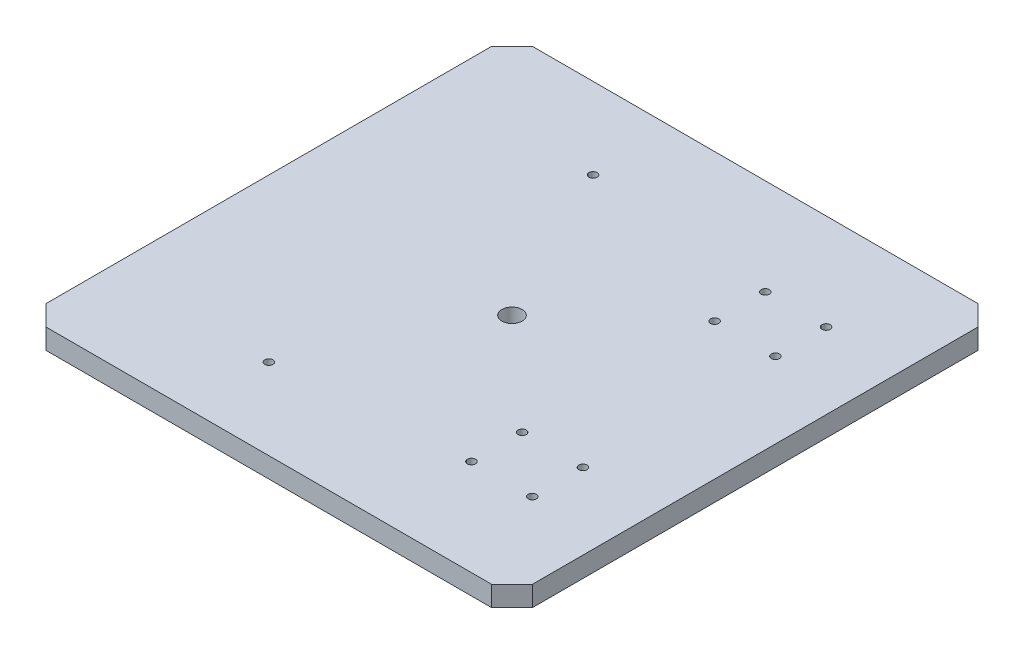
from build123d import *

# Parameters (mm, degrees)
SKETCH1_W               = 304.8
SKETCH1_H               = 304.8
BOSS_EXTRUDE1_DEPTH     = 12.7
CHAMFER1_SIZE           = 12.7
F_1_4_20_TAPPED_HOLE1_D = 5.1054
CUT_EXTRUDE1_DEPTH      = 432.239341897
CUT_EXTRUDE1_DEPTH_BACK = 432.239341897
SKETCH4_R               = 6.35
F_1_4_20_TAPPED_HOLE2_D = 5.1054


with BuildPart() as part:
    # Sketch1 → Boss-Extrude1 (new body)
    with BuildSketch(Plane(origin=(0, 0, 0), x_dir=(1, 0, 0), z_dir=(0, 1, 0))):
        with Locations((152.4, 152.4)):
            Rectangle(SKETCH1_W, SKETCH1_H)
    extrude(amount=BOSS_EXTRUDE1_DEPTH)

    # Chamfer1
    chamfer1_edges = [part.edges().sort_by_distance(p)[0] for p in [
        (0, 6.35, -304.8),
        (304.8, 6.35, -304.8),
        (304.8, 6.35, 0),
        (0, 6.35, 0),
    ]]
    chamfer(chamfer1_edges, length=CHAMFER1_SIZE)

    # 1/4-20 Tapped Hole1 (through all)
    with Locations(Plane(origin=(0, 12.7, 0), x_dir=(1, 0, 0), z_dir=(0, 1, 0))):
        with Locations((101.6, 50.8), (101.6, 254)):
            Hole(F_1_4_20_TAPPED_HOLE1_D / 2)

    # Sketch4 → Cut-Extrude1 (cut, two sides: drawn at the far end of the back side and taken through both)
    with BuildSketch(Plane(origin=(0, 12.7, 0), x_dir=(1, 0, 0), z_dir=(0, 1, 0)).offset(-CUT_EXTRUDE1_DEPTH_BACK)):
        with Locations(Location((152.4, 152.4, 0), (0, 0, 270))):
            Circle(SKETCH4_R)
    extrude(amount=CUT_EXTRUDE1_DEPTH + CUT_EXTRUDE1_DEPTH_BACK, mode=Mode.SUBTRACT)

    # 1/4-20 Tapped Hole2 (through all)
    with Locations(Plane(origin=(0, 12.7, 0), x_dir=(1, 0, 0), z_dir=(0, 1, 0))):
        with Locations((257.175, 244.475), (219.075, 244.475), (257.175, 212.725), (219.075, 212.725), (257.175, 92.075), (219.075, 92.075), (257.175, 60.325), (219.075, 60.325)):
            Hole(F_1_4_20_TAPPED_HOLE2_D / 2)


solid = part.part
